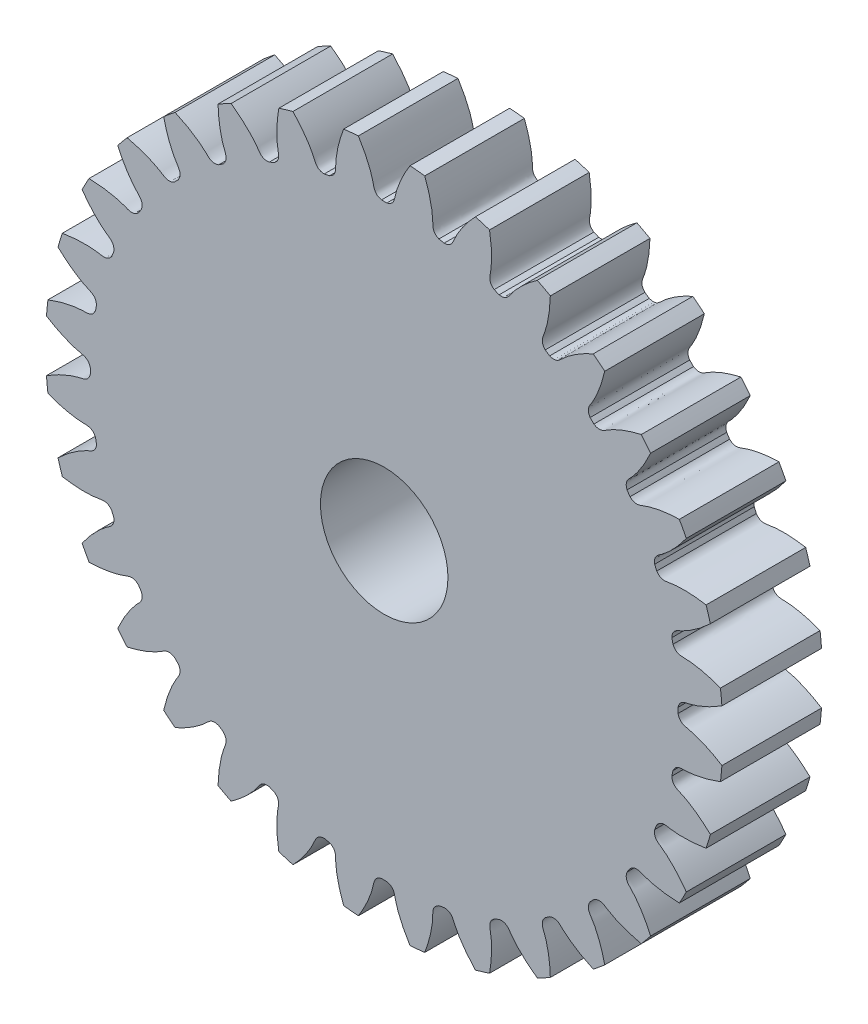
from build123d import *

# Parameters (mm, degrees)
SKETCH_1_R               = 8.5
EXTRUDE_1_DEPTH          = 2.5
CUT_EXTRUDE_1_DEPTH      = 13.278029158
PATTERN_CIRCULAR_1_COUNT = 32
CUT_EXTRUDE_2_REACH      = 14.244
SKETCH_4_R               = 1.6


with BuildPart() as part:
    # 草图1 → 凸台-拉伸1 (new body)
    with BuildSketch(Plane.XY):
        Circle(SKETCH_1_R)
    extrude(amount=EXTRUDE_1_DEPTH)

    # 草图2 → 切除-拉伸1 (cut, through all)
    with BuildSketch(Plane.XY):
        with BuildLine():
            ThreePointArc((0.067016057, 7.374695509), (0, 7.375), (-0.067016057, 7.374695509))
            add(Edge.make_bspline(
                [(-0.067016057, 7.374695509), (-0.244409752, 7.417585205), (-0.254185421, 7.546206625), (-0.286714327, 7.680381026), (-0.295183058, 7.71268082), (-0.305128683, 7.747692877), (-0.31664673, 7.785376713), (-0.32985255, 7.825680217), (-0.344853694, 7.868550436), (-0.361758143, 7.913930361), (-0.380671731, 7.961759942), (-0.401698795, 8.011975833), (-0.424941869, 8.064511528), (-0.450501667, 8.119297378), (-0.478476978, 8.176260642), (-0.508964584, 8.235325541), (-0.542059185, 8.296413305), (-0.577853311, 8.359442229), (-0.616437247, 8.424327727), (-0.657898954, 8.490982392), (-0.702323991, 8.559316051), (-0.749795443, 8.629235832), (-0.800393843, 8.700646224), (-0.854197106, 8.773449143), (-0.911280452, 8.847543999), (-0.971716342, 8.922827763), (-1.035574408, 8.999195043), (-1.102921392, 9.07653815), (-1.173821075, 9.154747175), (-1.248334222, 9.233710065), (-1.326518523, 9.313312698), (-1.40842851, 9.393438964), (-1.524138832, 9.502187768), (-1.614498649, 9.582084996), (-1.676516268, 9.63480345)],
                knots=[0, 0, 0, 0, 0.124532679, 0.135328735, 0.147193327, 0.160126453, 0.174128116, 0.189198313, 0.205337046, 0.222544314, 0.240820117, 0.260164456, 0.28057733, 0.302058739, 0.324608684, 0.348227164, 0.372914179, 0.39866973, 0.425493816, 0.453386438, 0.482347595, 0.512377287, 0.543475514, 0.575642277, 0.608877575, 0.643181408, 0.678553777, 0.714994681, 0.752504121, 0.791082096, 0.830728606, 0.871443651, 0.913227232, 1, 1, 1, 1], degree=3))
            ThreePointArc((-1.676516268, 9.63480345), (0, 9.779577922), (1.676516268, 9.63480345))
            add(Edge.make_bspline(
                [(0.067016057, 7.374695509), (0.244409752, 7.417585205), (0.254185421, 7.546206625), (0.286714327, 7.680381026), (0.295183058, 7.71268082), (0.305128683, 7.747692877), (0.31664673, 7.785376713), (0.32985255, 7.825680217), (0.344853694, 7.868550436), (0.361758143, 7.913930361), (0.380671731, 7.961759942), (0.401698795, 8.011975833), (0.424941869, 8.064511528), (0.450501667, 8.119297378), (0.478476978, 8.176260642), (0.508964584, 8.235325541), (0.542059185, 8.296413305), (0.577853311, 8.359442229), (0.616437247, 8.424327727), (0.657898954, 8.490982392), (0.702323991, 8.559316051), (0.749795443, 8.629235832), (0.800393843, 8.700646224), (0.854197106, 8.773449143), (0.911280452, 8.847543999), (0.971716342, 8.922827763), (1.035574408, 8.999195043), (1.102921392, 9.07653815), (1.173821075, 9.154747175), (1.248334222, 9.233710065), (1.326518523, 9.313312698), (1.40842851, 9.393438964), (1.524138832, 9.502187768), (1.614498649, 9.582084996), (1.676516268, 9.63480345)],
                knots=[0, 0, 0, 0, 0.124532679, 0.135328735, 0.147193327, 0.160126453, 0.174128116, 0.189198313, 0.205337046, 0.222544314, 0.240820117, 0.260164456, 0.28057733, 0.302058739, 0.324608684, 0.348227164, 0.372914179, 0.39866973, 0.425493816, 0.453386438, 0.482347595, 0.512377287, 0.543475514, 0.575642277, 0.608877575, 0.643181408, 0.678553777, 0.714994681, 0.752504121, 0.791082096, 0.830728606, 0.871443651, 0.913227232, 1, 1, 1, 1], degree=3))
        make_face()
    cut_extrude_1 = extrude(amount=CUT_EXTRUDE_1_DEPTH, mode=Mode.SUBTRACT)

    # 阵列(圆周)1: 切除-拉伸1 ×32 about axis
    pattern_circular_1_axis = Axis((0, 0, 2.5), (0, 0, -1))
    for i in range(1, PATTERN_CIRCULAR_1_COUNT):
        add(cut_extrude_1.rotate(pattern_circular_1_axis, i * 360 / PATTERN_CIRCULAR_1_COUNT), mode=Mode.SUBTRACT)

    # 草图4 → 切除-拉伸2 (cut, up to next)
    with BuildSketch(Plane(origin=(0, 0, 0), x_dir=(-1, 0, 0), z_dir=(0, 0, -1)), mode=Mode.PRIVATE) as cut_extrude_2_sk1:
        Circle(SKETCH_4_R)
    cut_extrude_2_tool1 = extrude(cut_extrude_2_sk1.sketch, amount=-CUT_EXTRUDE_2_REACH, mode=Mode.PRIVATE) & part.part
    add(cut_extrude_2_tool1.solids().sort_by_distance((0, 0, 0))[0], mode=Mode.SUBTRACT)


solid = part.part
